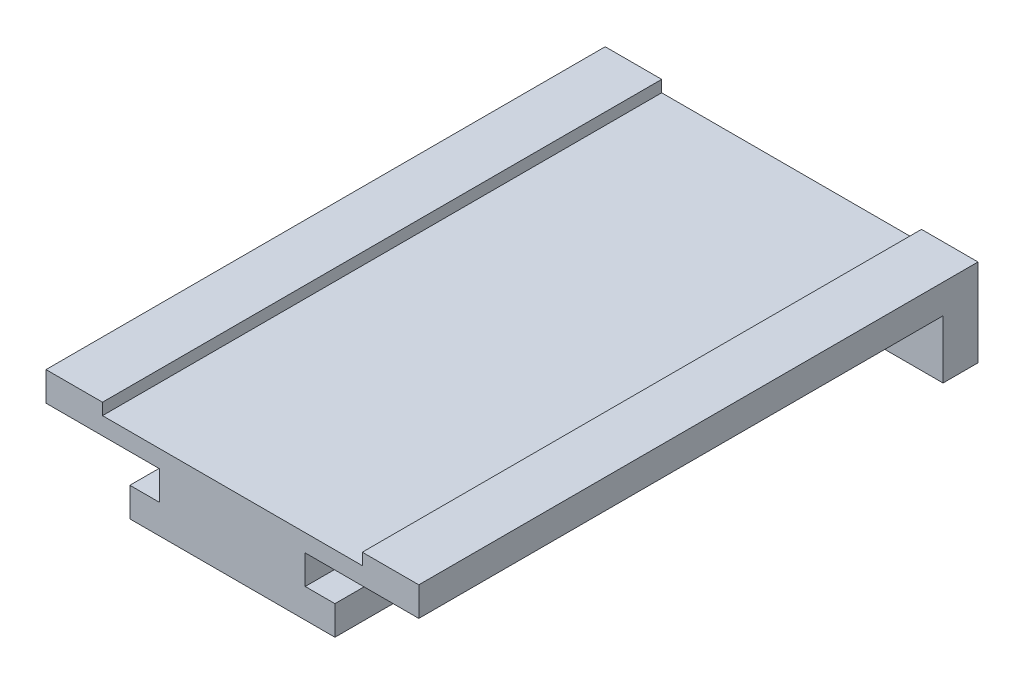
from build123d import *

# Parameters (mm, degrees)
SKETCH1_W           = 6.25
SKETCH1_H           = 2.5
SKETCH1_W_2         = 8.8
BOSS_EXTRUDE1_DEPTH = 45
SKETCH9_W           = 32
SKETCH9_H           = 7.5
BOSS_EXTRUDE3_DEPTH = 3
SKETCH10_W          = 11.15
SKETCH10_H          = 48
CUT_EXTRUDE3_DEPTH  = 1


with BuildPart() as part:
    # Sketch1 → Boss-Extrude1 (new body)
    with BuildSketch(Plane.XY):
        Polygon((-3.202898551, 2.789855072), (-3.202898551, 0.289855072), (3.047101449, 0.289855072), (12.797101449, 0.289855072), (12.797101449, 2.789855072), align=None)
        with Locations((-0.077898551, -0.960144928)):
            Rectangle(SKETCH1_W, SKETCH1_H)
        with Locations((1.197101449, -3.460144928)):
            Rectangle(SKETCH1_W_2, SKETCH1_H)
    boss_extrude1 = extrude(amount=BOSS_EXTRUDE1_DEPTH)

    # Mirror1: Boss-Extrude1 across plane
    add(boss_extrude1.mirror(Plane(origin=(-3.202898551, 0, 45), x_dir=(0, 0, 1), z_dir=(-1, 0, 0))))

    # Cut-Extrude2 cone 1 section (through the dimple's axis) → Cut-Extrude2 (revolve, cut)
    with BuildSketch(Plane(origin=(-3.202898551, -4.710144928, 32.5), x_dir=(0, 0, -1), z_dir=(1, 0, 0))):
        Polygon((0, 0), (1.5, 0), (0, 1.5), align=None)
    revolve(axis=Axis((-3.202898551, -4.710144928, 32.5), (0, 1, 0)), mode=Mode.SUBTRACT)

    # Cut-Extrude2 cone 2 section (through the dimple's axis) → Cut-Extrude2 cone 2 (revolve, cut)
    with BuildSketch(Plane(origin=(-3.202898551, -4.710144928, 12.5), x_dir=(0, 0, -1), z_dir=(1, 0, 0))):
        Polygon((0, 0), (1.5, 0), (0, 1.5), align=None)
    revolve(axis=Axis((-3.202898551, -4.710144928, 12.5), (0, 1, 0)), mode=Mode.SUBTRACT)

    # Sketch9 → Boss-Extrude3 (add)
    with BuildSketch(Plane(origin=(0, 0, 0), x_dir=(-1, 0, 0), z_dir=(0, 0, -1))):
        with Locations((3.202898551, -0.960144928)):
            Rectangle(SKETCH9_W, SKETCH9_H)
    extrude(amount=BOSS_EXTRUDE3_DEPTH)

    # Sketch10 → Cut-Extrude3 (cut)
    with BuildSketch(Plane(origin=(0, 2.789855072, 0), x_dir=(1, 0, 0), z_dir=(0, 1, 0))):
        with Locations((-8.777898551, -21)):
            Rectangle(SKETCH10_W, SKETCH10_H)
        with Locations((2.372101449, -21)):
            Rectangle(SKETCH10_W, SKETCH10_H)
    extrude(amount=-CUT_EXTRUDE3_DEPTH, mode=Mode.SUBTRACT)


solid = part.part
